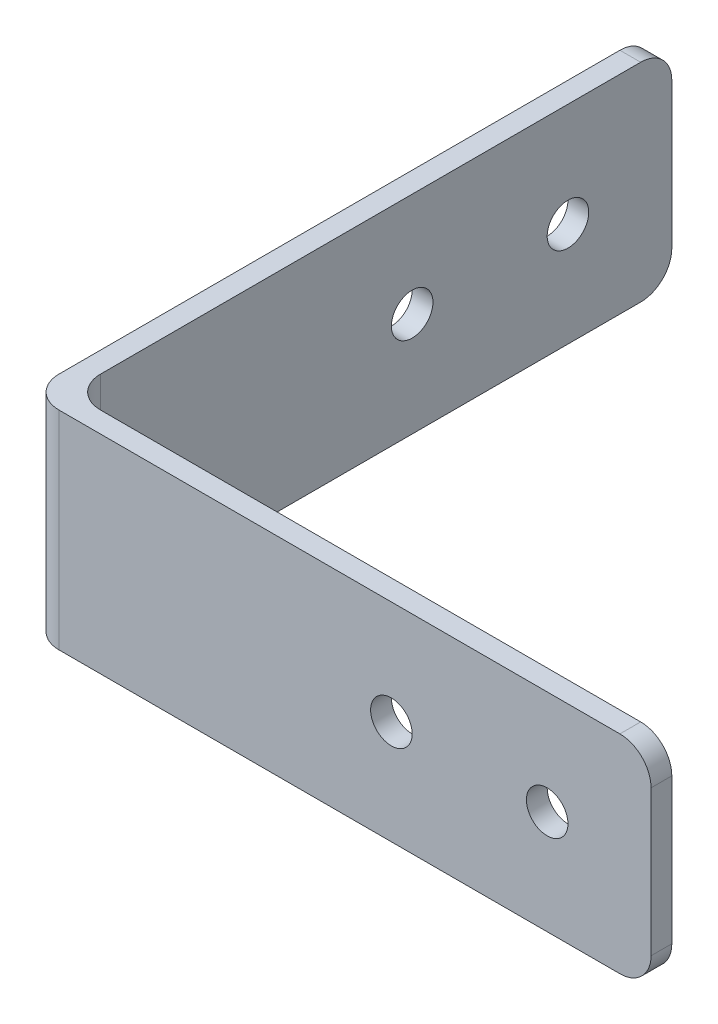
from build123d import *

# Parameters (mm, degrees)
BOSS_EXTRUDE1_DEPTH = 20
FILLET1_R           = 3
SKETCH3_R           = 2
CUT_EXTRUDE1_DEPTH  = 70.971255469
SKETCH4_R           = 2
CUT_EXTRUDE2_DEPTH  = 72.314067462


with BuildPart() as part:
    # Sketch1 → Boss-Extrude1 (new body)
    with BuildSketch(Plane(origin=(0, 0, 0), x_dir=(1, 0, 0), z_dir=(0, 1, 0))):
        Polygon((-31.644859813, 36.355140187), (-31.644859813, -21.644859813), (26.355140187, -21.644859813), (26.355140187, -23.644859813), (-33.644859813, -23.644859813), (-33.644859813, 36.355140187), align=None)
    extrude(amount=BOSS_EXTRUDE1_DEPTH)

    # Fillet1
    fillet1_edges = [part.edges().sort_by_distance(p)[0] for p in [
        (-31.644859813, 10, 21.644859813),
        (-33.644859813, 10, 23.644859813),
        (26.355140187, 20, 22.644859813),
        (-32.644859813, 20, -36.355140187),
        (26.355140187, 0, 22.644859813),
        (-32.644859813, 0, -36.355140187),
    ]]
    fillet(fillet1_edges, radius=FILLET1_R)

    # Sketch3 → Cut-Extrude1 (cut, through all)
    with BuildSketch(Plane(origin=(0, 0, 21.644859813), x_dir=(-1, 0, 0), z_dir=(0, 0, -1))):
        with Locations((-1.355140187, 10)):
            Circle(SKETCH3_R)
        with Locations((-16.355140187, 10)):
            Circle(SKETCH3_R)
    extrude(amount=-CUT_EXTRUDE1_DEPTH, mode=Mode.SUBTRACT)

    # Sketch4 → Cut-Extrude2 (cut, through all)
    with BuildSketch(Plane(origin=(-31.644859813, 0, 0), x_dir=(0, 0, -1), z_dir=(1, 0, 0))):
        with Locations((26.355140187, 10)):
            Circle(SKETCH4_R)
        with Locations((11.355140187, 10)):
            Circle(SKETCH4_R)
    extrude(amount=-CUT_EXTRUDE2_DEPTH, mode=Mode.SUBTRACT)


solid = part.part
